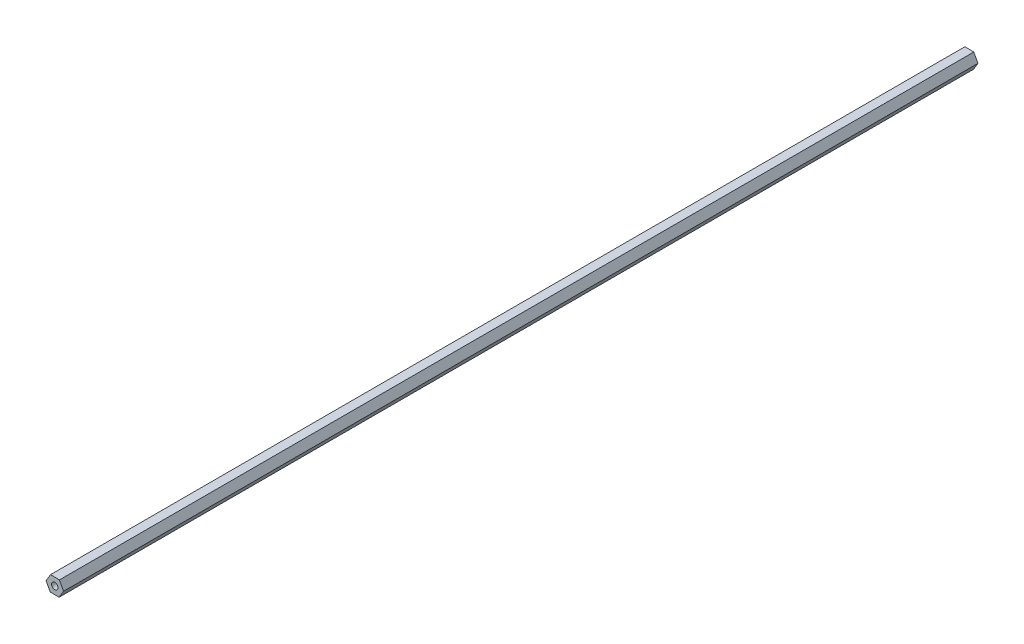
from build123d import *

# Parameters (mm, degrees)
SKETCH1_R           = 2.667
BOSS_EXTRUDE2_DEPTH = 762


with BuildPart() as part:
    # Sketch1 → Boss-Extrude2 (new body)
    with BuildSketch(Plane.XY):
        Polygon((3.518151267, -6.433190888), (7.33038237, -0.169787073), (3.812231103, 6.263403815), (-3.518151267, 6.433190888), (-7.33038237, 0.169787073), (-3.812231103, -6.263403815), align=None)
        Circle(SKETCH1_R, mode=Mode.SUBTRACT)
    extrude(amount=BOSS_EXTRUDE2_DEPTH)


solid = part.part
